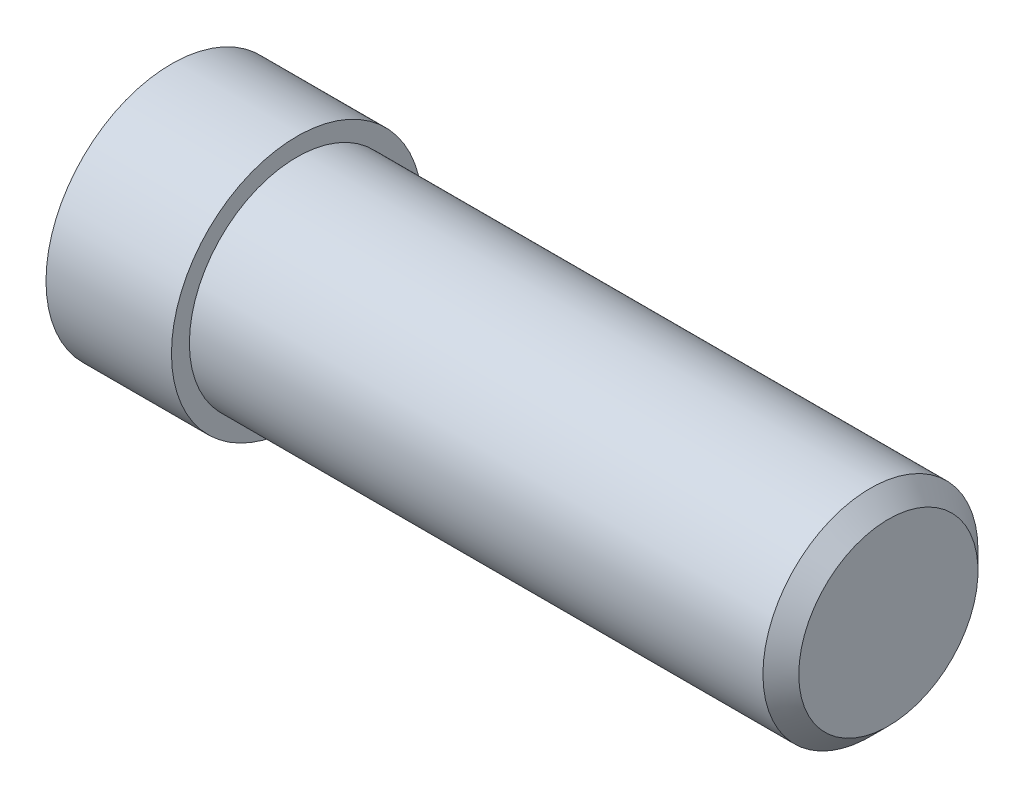
from build123d import *

# Parameters (mm, degrees)
CHAMFER1_SIZE = 1


with BuildPart() as part:
    # Sketch1 → Revolve1 (revolve)
    with BuildSketch(Plane.XY, mode=Mode.PRIVATE) as revolve1_sk:
        Polygon((0, 0), (0, 6), (-33, 6), (-33, 7), (-40, 7), (-40, 0), align=None)
    revolve(revolve1_sk.sketch.rotate(Axis((-40, 0, 0), (1, 0, 0)), 90), axis=Axis((-40, 0, 0), (1, 0, 0)))

    # Chamfer1
    chamfer1_edges = [part.edges().sort_by_distance(p)[0] for p in [
        (0, 0, -6),
    ]]
    chamfer(chamfer1_edges, length=CHAMFER1_SIZE)


solid = part.part
